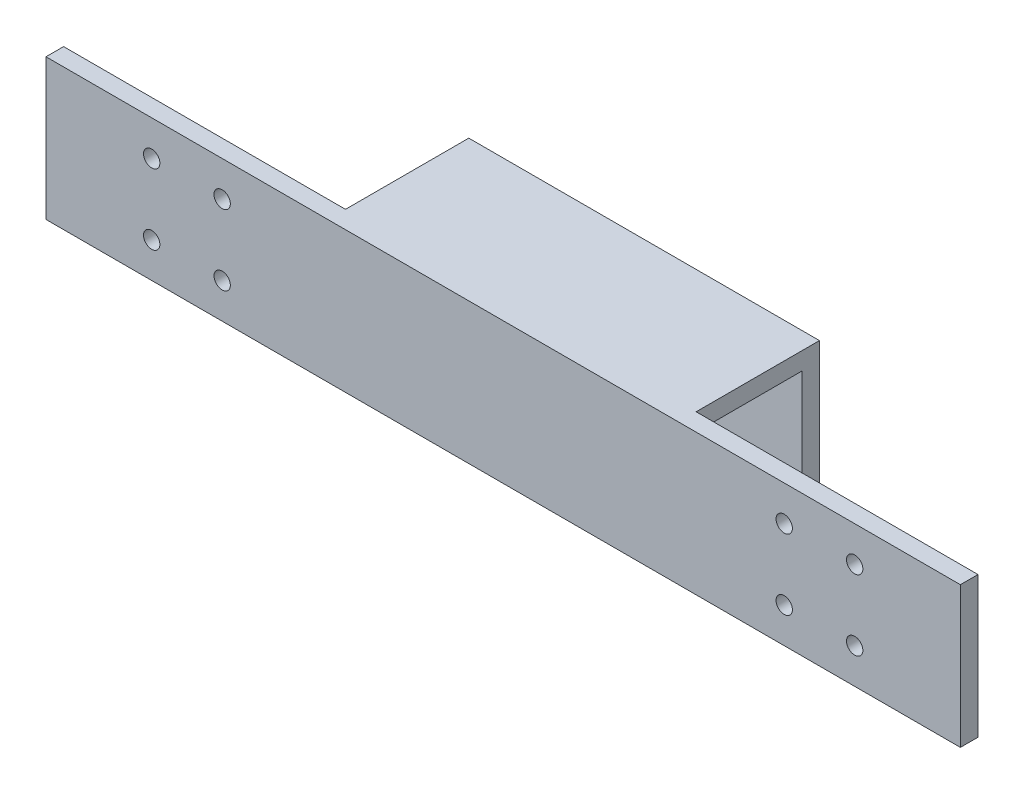
from build123d import *

# Parameters (mm, degrees)
SKETCH1_W           = 25.4
SKETCH1_H           = 25.4
SKETCH1_W_2         = 19.05
SKETCH1_H_2         = 19.05
BOSS_EXTRUDE1_DEPTH = 164.8
SKETCH2_W           = 22.225
SKETCH2_H           = 25.4
CUT_EXTRUDE1_DEPTH  = 50.8
SKETCH3_W           = 22.225
SKETCH3_H           = 25.4
CUT_EXTRUDE2_DEPTH  = 50.8
SKETCH4_R           = 1.4732
CUT_EXTRUDE3_DEPTH  = 50.8


with BuildPart() as part:
    # Sketch1 → Boss-Extrude1 (new body)
    with BuildSketch(Plane(origin=(0, 0, 0), x_dir=(0, 0, -1), z_dir=(1, 0, 0))):
        with Locations((3.400546448, -4.580327869)):
            Rectangle(SKETCH1_W, SKETCH1_H)
        with Locations((3.400546448, -4.580327869)):
            Rectangle(SKETCH1_W_2, SKETCH1_H_2, mode=Mode.SUBTRACT)
    extrude(amount=BOSS_EXTRUDE1_DEPTH)

    # Sketch2 → Cut-Extrude1 (cut)
    with BuildSketch(Plane(origin=(164.8, 0, 0), x_dir=(0, 0, -1), z_dir=(1, 0, 0))):
        with Locations((4.988046448, -4.580327869)):
            Rectangle(SKETCH2_W, SKETCH2_H)
    extrude(amount=-CUT_EXTRUDE1_DEPTH, mode=Mode.SUBTRACT)

    # Sketch3 → Cut-Extrude2 (cut)
    with BuildSketch(Plane.ZY):
        with Locations((-4.988046448, -4.580327869)):
            Rectangle(SKETCH3_W, SKETCH3_H)
    extrude(amount=-CUT_EXTRUDE2_DEPTH, mode=Mode.SUBTRACT)

    # Sketch4 → Cut-Extrude3 (cut)
    with BuildSketch(Plane.XY.offset(9.299453552)):
        with Locations((19.05, 1.769672131)):
            Circle(SKETCH4_R)
        with Locations(Location((31.75, 1.769672131, 0), (0, 0, 180))):
            Circle(SKETCH4_R)
        with Locations((31.75, -10.930327869)):
            Circle(SKETCH4_R)
        with Locations(Location((19.05, -10.930327869, 0), (0, 0, 180))):
            Circle(SKETCH4_R)
        with Locations((145.75, -10.930327869)):
            Circle(SKETCH4_R)
        with Locations(Location((133.05, -10.930327869, 0), (0, 0, 180))):
            Circle(SKETCH4_R)
        with Locations((133.05, 1.769672131)):
            Circle(SKETCH4_R)
        with Locations(Location((145.75, 1.769672131, 0), (0, 0, 180))):
            Circle(SKETCH4_R)
    extrude(amount=-CUT_EXTRUDE3_DEPTH, mode=Mode.SUBTRACT)


solid = part.part
